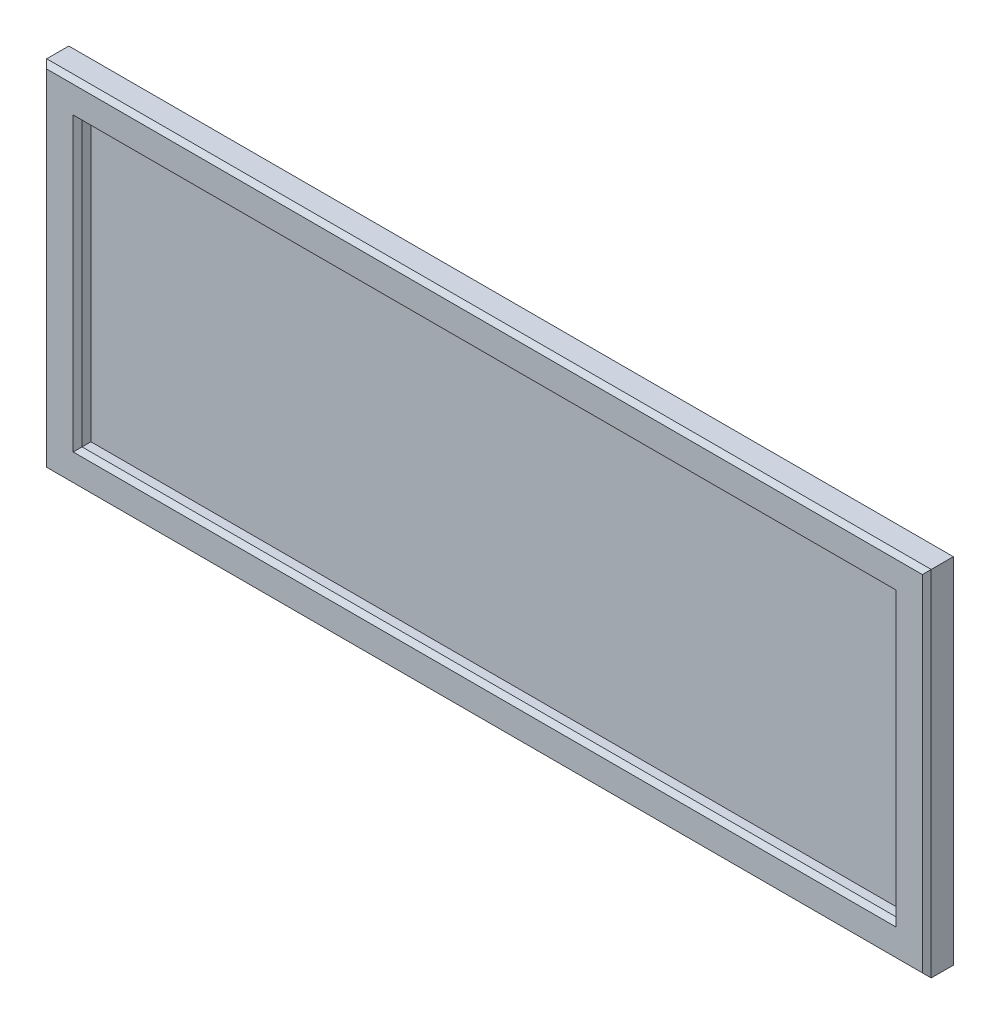
from build123d import *

# Parameters (mm, degrees)
SKETCH_1_W      = 2000
SKETCH_1_H      = 800
SKETCH_1_W_2    = 1840
SKETCH_1_H_2    = 640
EXTRUDE_1_DEPTH = 60
CHAMFER_1_SIZE  = 10
EXTRUDE_START   = -20
SKETCH_2_W      = 1917.056190877
SKETCH_2_H      = 714.541967462
EXTRUDE_2_DEPTH = 10


with BuildPart() as part:
    # Эскиз1 → Бобышка-Вытянуть1 (new body)
    with BuildSketch(Plane.XY):
        with Locations((1000, 400)):
            Rectangle(SKETCH_1_W, SKETCH_1_H)
        with Locations((1000, 400)):
            Rectangle(SKETCH_1_W_2, SKETCH_1_H_2, mode=Mode.SUBTRACT)
    extrude(amount=EXTRUDE_1_DEPTH)

    # Фаска1
    chamfer_1_edges = [part.edges().sort_by_distance(p)[0] for p in [
        (2000, 400, 60),
        (1000, 80, 60),
        (1000, 800, 60),
        (1920, 400, 60),
        (1000, 720, 60),
        (80, 400, 60),
        (0, 400, 60),
        (1000, 0, 60),
    ]]
    chamfer(chamfer_1_edges, length=CHAMFER_1_SIZE)


with BuildPart() as body_2:
    # Эскиз2 → Бобышка-Вытянуть2 (new body)
    with BuildSketch(Plane(origin=(0, 0, 0), x_dir=(-1, 0, 0), z_dir=(0, 0, -1)).offset(EXTRUDE_START)):
        with Locations((-1000.387839242, 394.784365201)):
            Rectangle(SKETCH_2_W, SKETCH_2_H)
    extrude(amount=-EXTRUDE_2_DEPTH)


solid = Compound([part.part, body_2.part])
